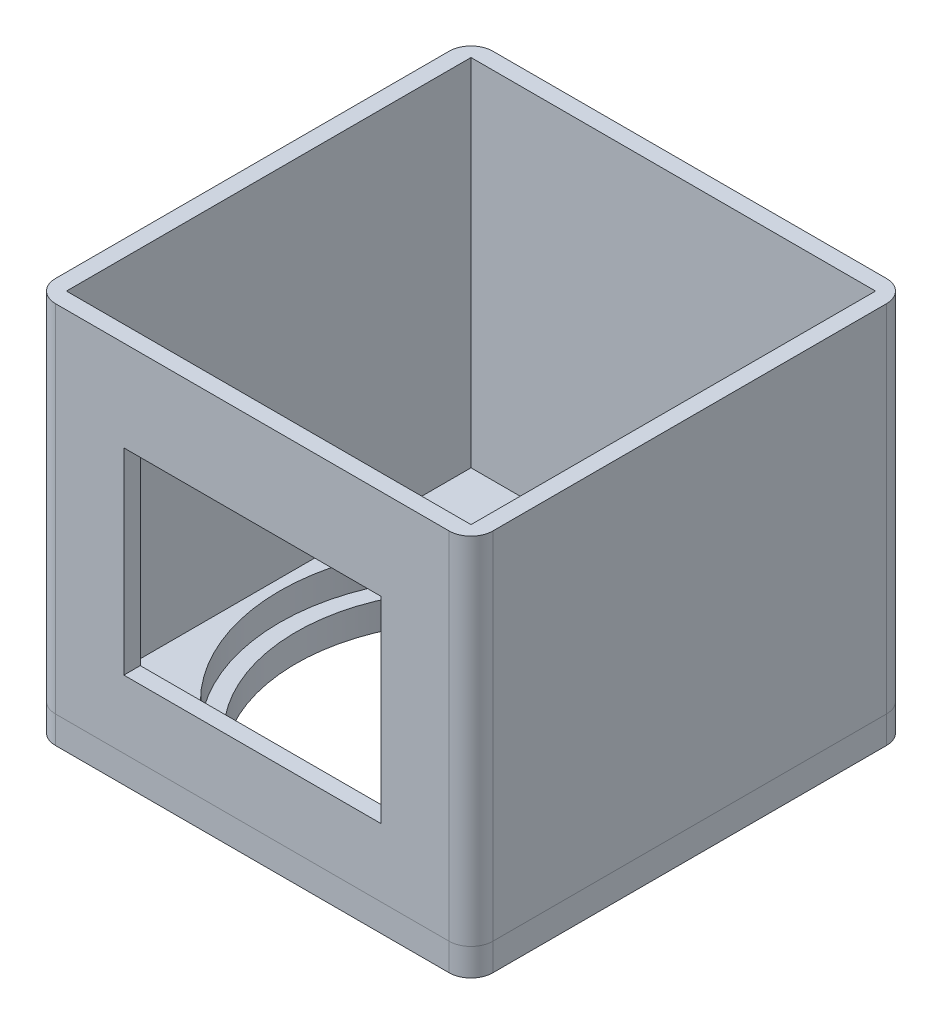
from build123d import *

# Parameters (mm, degrees)
SKETCH1_R           = 35
SKETCH1_R_2         = 32
BOSS_EXTRUDE1_DEPTH = 5
SKETCH2_W           = 80
SKETCH2_H           = 80
SKETCH2_R           = 35
BOSS_EXTRUDE3_DEPTH = 5
SKETCH9_W           = 80
SKETCH9_H           = 80
SKETCH9_W_2         = 74
SKETCH9_H_2         = 74
BOSS_EXTRUDE4_DEPTH = 65
SKETCH11_W          = 47
SKETCH11_H          = 36
CUT_EXTRUDE2_DEPTH  = 3
FILLET1_R           = 4
FILLET2_R           = 4


with BuildPart() as part:
    # Sketch1 → Boss-Extrude1 (new body)
    with BuildSketch(Plane(origin=(0, 0, 0), x_dir=(1, 0, 0), z_dir=(0, 1, 0))):
        with Locations(Location((0, 0, 0), (0, 0, 270))):
            Circle(SKETCH1_R)
        with Locations(Location((0, 0, 0), (0, 0, 270))):
            Circle(SKETCH1_R_2, mode=Mode.SUBTRACT)
    extrude(amount=BOSS_EXTRUDE1_DEPTH)


with BuildPart() as body_2:
    # Sketch2 → Boss-Extrude3 (new body)
    with BuildSketch(Plane(origin=(0, 5, 0), x_dir=(1, 0, 0), z_dir=(0, 1, 0))):
        Rectangle(SKETCH2_W, SKETCH2_H)
        with Locations(Location((0, 0, 0), (0, 0, 270))):
            Circle(SKETCH2_R, mode=Mode.SUBTRACT)
    extrude(amount=BOSS_EXTRUDE3_DEPTH)

    # Fillet1
    fillet1_edges = [body_2.edges().sort_by_distance(p)[0] for p in [
        (40, 7.5, 40),
        (-40, 7.5, 40),
        (-40, 7.5, -40),
        (40, 7.5, -40),
    ]]
    fillet(fillet1_edges, radius=FILLET1_R)


with BuildPart() as body_3:
    # Sketch9 → Boss-Extrude4 (new body)
    with BuildSketch(Plane(origin=(0, 10, 0), x_dir=(1, 0, 0), z_dir=(0, 1, 0))):
        Rectangle(SKETCH9_W, SKETCH9_H)
        Rectangle(SKETCH9_W_2, SKETCH9_H_2, mode=Mode.SUBTRACT)
    extrude(amount=BOSS_EXTRUDE4_DEPTH)

    # Sketch11 → Cut-Extrude2 (cut)
    with BuildSketch(Plane.XY.offset(40)):
        with Locations((0, 40.410944599)):
            Rectangle(SKETCH11_W, SKETCH11_H)
    extrude(amount=-CUT_EXTRUDE2_DEPTH, mode=Mode.SUBTRACT)

    # Fillet2
    fillet2_edges = [body_3.edges().sort_by_distance(p)[0] for p in [
        (-40, 42.5, -40),
        (40, 42.5, -40),
        (40, 42.5, 40),
        (-40, 42.5, 40),
    ]]
    fillet(fillet2_edges, radius=FILLET2_R)


solid = Compound([part.part, body_2.part, body_3.part])
